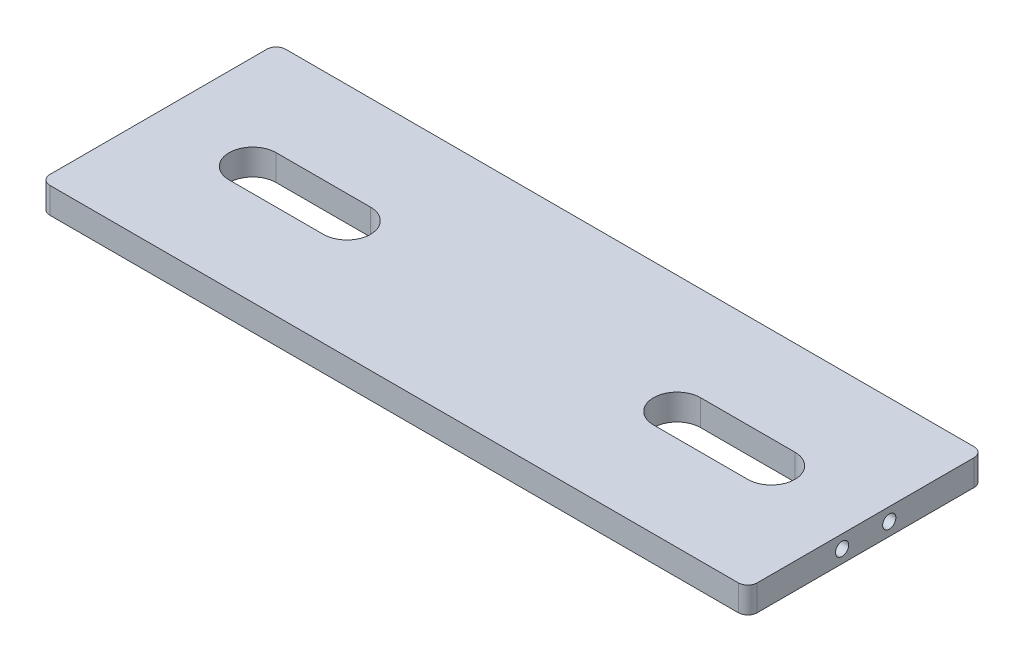
from build123d import *

# Parameters (mm, degrees)
SKETCH1_W           = 150
SKETCH1_H           = 50
BOSS_EXTRUDE1_DEPTH = 5.5
SKETCH2_R           = 1.4
CUT_EXTRUDE1_DEPTH  = 7
FILLET1_R           = 2
SKETCH5_W           = 1.13974359
SKETCH5_H           = 12.7
BOSS_EXTRUDE3_DEPTH = 1
BOSS_EXTRUDE2_DEPTH = 1


with BuildPart() as part:
    # Sketch1 → Boss-Extrude1 (new body)
    with BuildSketch(Plane(origin=(0, 0, 0), x_dir=(1, 0, 0), z_dir=(0, 1, 0))):
        Rectangle(SKETCH1_W, SKETCH1_H)
        with BuildLine():
            Line((-55, 5), (-35, 5))
            ThreePointArc((-35, 5), (-30, 0), (-35, -5))
            Line((-35, -5), (-55, -5))
            ThreePointArc((-55, -5), (-60, 0), (-55, 5))
        make_face(mode=Mode.SUBTRACT)
        with BuildLine():
            Line((55, 5), (35, 5))
            ThreePointArc((35, 5), (30, 0), (35, -5))
            Line((35, -5), (55, -5))
            ThreePointArc((55, -5), (60, 0), (55, 5))
        make_face(mode=Mode.SUBTRACT)
    extrude(amount=BOSS_EXTRUDE1_DEPTH)

    # Sketch2 → Cut-Extrude1 (cut)
    with BuildSketch(Plane.ZY.offset(75)):
        with Locations((-5, 2.75)):
            Circle(SKETCH2_R)
        with Locations((5, 2.75)):
            Circle(SKETCH2_R)
    cut_extrude1 = extrude(amount=-CUT_EXTRUDE1_DEPTH, mode=Mode.SUBTRACT)

    # Mirror1: Cut-Extrude1 across plane
    add(cut_extrude1.mirror(Plane(origin=(0, 0, 0), x_dir=(0, 0, 1), z_dir=(1, 0, 0))), mode=Mode.SUBTRACT)

    # Fillet1
    fillet1_edges = [part.edges().sort_by_distance(p)[0] for p in [
        (75, 2.75, 25),
        (75, 2.75, -25),
        (-75, 2.75, -25),
        (-75, 2.75, 25),
    ]]
    fillet(fillet1_edges, radius=FILLET1_R)

    # Sketch5 → Boss-Extrude3 (add)
    # profile 1 of 7: a face of its own
    with BuildSketch(Plane.XZ):
        Polygon((-32.726923077, -10.3), (-25.562820513, -10.3), (-25.562820513, -11.602564103), (-31.587179487, -11.602564103), (-31.587179487, -15.51025641), (-25.562820513, -15.51025641), (-25.562820513, -16.812820513), (-31.587179487, -16.812820513), (-31.587179487, -21.697435897), (-25.562820513, -21.697435897), (-25.562820513, -23), (-32.726923077, -23), align=None)
    # profile 2 of 7: a face of its own
    with BuildSketch(Plane.XZ):
        Polygon((-24.178846154, -10.3), (-22.863561699, -10.3), (-19.541005609, -15.492447917), (-16.22099359, -10.3), (-14.898076923, -10.3), (-18.879547276, -16.522796474), (-14.73525641, -23), (-16.050540865, -23), (-19.538461538, -17.550600962), (-23.023838141, -23), (-24.341666667, -23), (-20.197375801, -16.520252404), align=None)
    # profile 3 of 7: a face of its own
    with BuildSketch(Plane.XZ):
        with BuildLine():
            Line((-12.537179487, -10.3), (-10.046534455, -10.3))
            add(Edge.make_bspline(
                [(-10.046534455, -10.3), (-9.87522631, -10.300188309), (-9.546992296, -10.300549118), (-9.076311951, -10.311488339), (-8.648830925, -10.326099478), (-8.265470971, -10.346353777), (-7.925052558, -10.370289976), (-7.629116071, -10.403861661), (-7.375335395, -10.438914734), (-7.22327485, -10.474552409), (-7.153926282, -10.490805288)],
                knots=[0, 0, 0, 0, 1.415646017, 2.712440637, 3.8905458, 4.950247383, 5.884950622, 6.709939814, 7.411656543, 8, 8, 8, 8], degree=3))
            add(Edge.make_bspline(
                [(-7.153926282, -10.490805288), (-7.066138317, -10.514833506), (-6.892630999, -10.562323747), (-6.642618643, -10.657442115), (-6.404751832, -10.770225972), (-6.178214463, -10.898764268), (-5.965790333, -11.048571887), (-5.764310127, -11.213576157), (-5.575551913, -11.397586706), (-5.400577148, -11.598539676), (-5.239886597, -11.81306158), (-5.10153032, -12.044354815), (-4.985680096, -12.288526115), (-4.886317939, -12.545405645), (-4.814804404, -12.817150533), (-4.760931368, -13.101872604), (-4.726737062, -13.399541337), (-4.723462053, -13.60295857), (-4.721794872, -13.706510417)],
                knots=[0, 0, 0, 0, 0.999701418, 1.975846123, 2.934577507, 3.890451536, 4.834027766, 5.787354733, 6.749476667, 7.726910423, 8.712836071, 9.690891519, 10.682875813, 11.679750201, 12.712814741, 13.765529915, 14.8625177, 16, 16, 16, 16], degree=3))
            add(Edge.make_bspline(
                [(-4.721794872, -13.706510417), (-4.723324042, -13.810932635), (-4.726315965, -14.015241759), (-4.762225344, -14.314137304), (-4.810594896, -14.599772606), (-4.884969914, -14.871514326), (-4.982381357, -15.127748693), (-5.09665252, -15.372391449), (-5.234478473, -15.601280545), (-5.392846855, -15.815246943), (-5.569019783, -16.014491481), (-5.762251873, -16.197570307), (-5.97176302, -16.363411764), (-6.196887386, -16.512387639), (-6.439819695, -16.641043282), (-6.696875509, -16.756276931), (-6.970289152, -16.85305478), (-7.159491988, -16.90396386), (-7.255689103, -16.929847756)],
                knots=[0, 0, 0, 0, 1.121902311, 2.195077645, 3.232258892, 4.234102512, 5.217864754, 6.176164875, 7.132989551, 8.084763148, 9.034132444, 9.988522005, 10.94243251, 11.903244335, 12.886203696, 13.894208494, 14.929344452, 16, 16, 16, 16], degree=3))
            add(Edge.make_bspline(
                [(-7.255689103, -16.929847756), (-7.335254, -16.946767716), (-7.509625099, -16.983848792), (-7.79680012, -17.025245193), (-8.131156235, -17.060578772), (-8.512237079, -17.087071472), (-8.939700591, -17.10975138), (-9.41377801, -17.127778464), (-9.935399948, -17.137683933), (-10.299241319, -17.13819481), (-10.489202724, -17.138461538)],
                knots=[0, 0, 0, 0, 0.601384939, 1.31797006, 2.144135048, 3.087295005, 4.142315834, 5.309527816, 6.595305764, 8, 8, 8, 8], degree=3))
            Line((-10.489202724, -17.138461538), (-11.397435897, -17.138461538))
            Line((-11.397435897, -17.138461538), (-11.397435897, -23))
            Line((-11.397435897, -23), (-12.537179487, -23))
            Line((-12.537179487, -23), (-12.537179487, -10.3))
        make_face()
        with BuildLine():
            Line((-11.397435897, -11.602564103), (-11.397435897, -15.835897436))
            Line((-11.397435897, -15.835897436), (-9.173918269, -15.863882212))
            add(Edge.make_bspline(
                [(-9.173918269, -15.863882212), (-9.065351681, -15.863938322), (-8.855766122, -15.864046643), (-8.553011826, -15.849585975), (-8.272126698, -15.832892613), (-8.013973524, -15.808450834), (-7.778435933, -15.773902271), (-7.565121186, -15.739025394), (-7.375683331, -15.688568792), (-7.153980513, -15.620630798), (-6.906935223, -15.504761022), (-6.638175833, -15.336577135), (-6.410408277, -15.122198565), (-6.213310457, -14.881160434), (-6.0568977, -14.613012165), (-5.942394528, -14.32610488), (-5.875116614, -14.023380969), (-5.866095283, -13.816232579), (-5.861538462, -13.711598558)],
                knots=[0, 0, 0, 0, 1.160613943, 2.240541288, 3.23993089, 4.169200891, 5.011653406, 5.7853311, 6.478053781, 7.106038997, 8.262395093, 9.384106736, 10.481365981, 11.59014053, 12.70357646, 13.786202915, 14.881775077, 16, 16, 16, 16], degree=3))
            add(Edge.make_bspline(
                [(-5.861538462, -13.711598558), (-5.866120065, -13.609495952), (-5.875227724, -13.406528608), (-5.942921856, -13.109062819), (-6.056675081, -12.825178978), (-6.214360438, -12.560390925), (-6.405735395, -12.320220122), (-6.62816444, -12.11158769), (-6.881123989, -11.94386894), (-7.116430427, -11.835616746), (-7.325440445, -11.769521318), (-7.506984985, -11.723275755), (-7.711965432, -11.68635284), (-7.940448518, -11.656455216), (-8.190663315, -11.630861228), (-8.464759486, -11.613494968), (-8.761698706, -11.603329684), (-8.967839921, -11.602825475), (-9.074699519, -11.602564103)],
                knots=[0, 0, 0, 0, 1.120700087, 2.227813068, 3.331159281, 4.466773991, 5.599788987, 6.693661531, 7.80175334, 8.91857717, 9.525282508, 10.207424825, 10.974604443, 11.810962634, 12.737642355, 13.736264703, 14.826523623, 16, 16, 16, 16], degree=3))
            Line((-9.074699519, -11.602564103), (-11.397435897, -11.602564103))
        make_face(mode=Mode.SUBTRACT)
    # profile 4 of 7: a face of its own
    with BuildSketch(Plane.XZ):
        with Locations((-1.546794872, -16.65)):
            Rectangle(SKETCH5_W, SKETCH5_H)
    # profile 5 of 7: a face of its own
    with BuildSketch(Plane.XZ):
        Polygon((2.279487179, -10.3), (9.443589744, -10.3), (9.443589744, -11.602564103), (3.419230769, -11.602564103), (3.419230769, -15.51025641), (9.443589744, -15.51025641), (9.443589744, -16.812820513), (3.419230769, -16.812820513), (3.419230769, -21.697435897), (9.443589744, -21.697435897), (9.443589744, -23), (2.279487179, -23), align=None)
    # profile 6 of 7: a face of its own
    with BuildSketch(Plane.XZ):
        Polygon((15.305128205, -13.719230769), (16.536458333, -13.719230769), (19.617327724, -20.478826122), (22.700741186, -13.719230769), (23.934615385, -13.719230769), (19.701282051, -23), (19.538461538, -23), align=None)
    # profile 7 of 7: a face of its own
    with BuildSketch(Plane.XZ):
        Polygon((27.773617788, -10.3), (30.121794872, -10.3), (30.121794872, -23), (28.982051282, -23), (28.982051282, -11.602564103), (27.028205128, -11.602564103), align=None)
    extrude(amount=BOSS_EXTRUDE3_DEPTH)

    # Sketch4 → Boss-Extrude2 (add)
    # profile 1 of 4: a face of its own
    with BuildSketch(Plane.XZ):
        with BuildLine():
            ThreePointArc((23.346599188, 16.277289536), (23.394954672, 16.759975802), (22.930168778, 16.898894325))
            Line((22.930168778, 16.898894325), (7.111563941, 10.217079255))
            ThreePointArc((7.111563941, 10.217079255), (6.942290331, 10.076672909), (6.878815926, 9.866105825))
            Line((6.878815926, 9.866105825), (6.878815926, 0.872691758))
            ThreePointArc((6.878815926, 0.872691758), (7.113212686, 0.521026449), (7.527994351, 0.602060401))
            Line((7.527994351, 0.602060401), (23.346599188, 16.277289536))
        make_face()
        Polygon((8.148815926, 3.005185292), (8.148815926, 9.276565513), (19.179608543, 13.935997688), align=None, mode=Mode.SUBTRACT)
    # profile 2 of 4: a face of its own
    with BuildSketch(Plane.XZ):
        with BuildLine():
            ThreePointArc((-3.457350574, 16.831881319), (-3.689367362, 16.504501535), (-3.499598589, 16.15095221))
            Line((-3.499598589, 16.15095221), (4.337266349, 11.626336128))
            ThreePointArc((4.337266349, 11.626336128), (4.607983595, 11.583832153), (4.837203006, 11.734008304))
            Line((4.837203006, 11.734008304), (12.917121907, 22.981910492))
            ThreePointArc((12.917121907, 22.981910492), (12.905428433, 23.44191231), (12.459433266, 23.555167425))
            Line((12.459433266, 23.555167425), (-3.457350574, 16.831881319))
        make_face()
        Polygon((4.275286603, 13.128589835), (-1.317020953, 16.357310108), (10.041035009, 21.154979072), align=None, mode=Mode.SUBTRACT)
    # profile 3 of 4: a face of its own
    with BuildSketch(Plane.XZ):
        Polygon((6.328889794, -2.898734042), (6.328889794, 9.801265958), (-4.669632834, 16.151265958), (-15.668155462, 9.801265958), (-15.668155462, -2.898734042), (-4.669632834, -9.248734042), align=None)
        Polygon((-14.525155462, 9.141354601), (-4.669632834, 14.831443243), (5.185889794, 9.141354601), (5.185889794, -2.238822684), (-4.669632834, -7.928911326), (-14.525155462, -2.238822684), align=None, mode=Mode.SUBTRACT)
    # profile 4 of 4: a face of its own
    with BuildSketch(Plane.XZ):
        with BuildLine():
            add(Edge.make_bspline(
                [(-7.255778738, 7.321413101), (-8.757188234, 1.265632682), (-5.861692491, 2.205410133), (-2.966196749, 3.145187583), (-5.075721943, 8.028983893)],
                knots=[1.031051121, 1.031051121, 1.031051121, 3.275114468, 3.275114468, 5.519177814, 5.519177814, 5.519177814], degree=2, weights=[1, 0.433852838, 1, 0.433852838, 1]))
            ThreePointArc((-7.255778738, 7.321413101), (-10.072058612, 5.399697159), (-12.083047764, 2.64645414))
            ThreePointArc((-12.083047764, 2.64645414), (-3.537183108, -0.475241331), (1.374737824, 7.183075593))
            ThreePointArc((1.374737824, 7.183075593), (-1.780093413, 8.142853459), (-5.075721943, 8.028983893))
        make_face()
    extrude(amount=BOSS_EXTRUDE2_DEPTH)


solid = part.part
